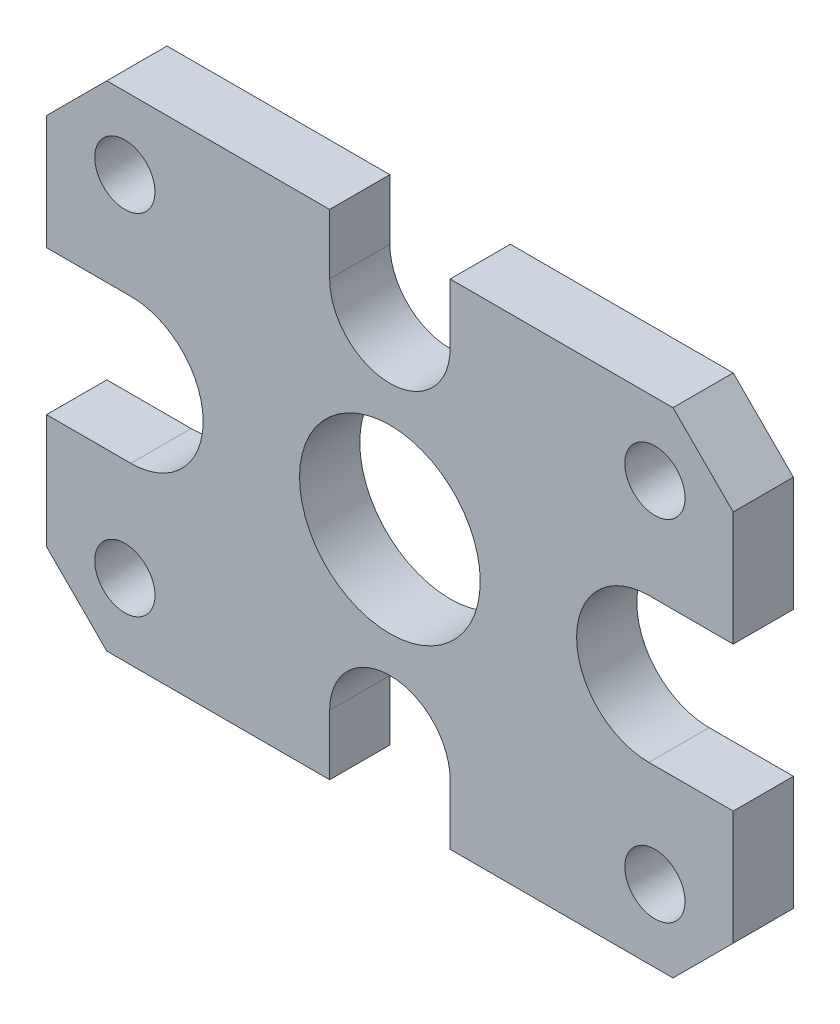
from build123d import *

# Parameters (mm, degrees)
SKETCH1_R           = 5
SKETCH1_R_2         = 15
BOSS_EXTRUDE1_DEPTH = 5


with BuildPart() as part:
    # Sketch1 → Boss-Extrude1 (new, symmetric)
    with BuildSketch(Plane.XY):
        with BuildLine():
            Line((-57, -31), (-47, -41))
            Line((-47, -41), (-10, -41))
            Line((-10, -41), (-10, -31))
            ThreePointArc((-10, -31), (0, -21), (10, -31))
            Line((10, -31), (10, -41))
            Line((10, -41), (47, -41))
            Line((47, -41), (57, -31))
            Line((57, -31), (57, -12))
            Line((57, -12), (43, -12))
            ThreePointArc((43, -12), (31, 0), (43, 12))
            Line((43, 12), (57, 12))
            Line((57, 12), (57, 31))
            Line((57, 31), (47, 41))
            Line((47, 41), (10, 41))
            Line((10, 41), (10, 31))
            ThreePointArc((10, 31), (0, 21), (-10, 31))
            Line((-10, 31), (-10, 41))
            Line((-10, 41), (-47, 41))
            Line((-47, 41), (-57, 31))
            Line((-57, 31), (-57, 12))
            Line((-57, 12), (-43, 12))
            ThreePointArc((-43, 12), (-31, 0), (-43, -12))
            Line((-43, -12), (-57, -12))
            Line((-57, -12), (-57, -31))
        make_face()
        with Locations((-44, -29)):
            Circle(SKETCH1_R, mode=Mode.SUBTRACT)
        with Locations(Location((-44, 29, 0), (0, 0, 180))):
            Circle(SKETCH1_R, mode=Mode.SUBTRACT)
        with Locations(Location((44, -29, 0), (0, 0, 180))):
            Circle(SKETCH1_R, mode=Mode.SUBTRACT)
        with Locations((44, 29)):
            Circle(SKETCH1_R, mode=Mode.SUBTRACT)
        Circle(SKETCH1_R_2, mode=Mode.SUBTRACT)
    extrude(amount=BOSS_EXTRUDE1_DEPTH, both=True)


solid = part.part
